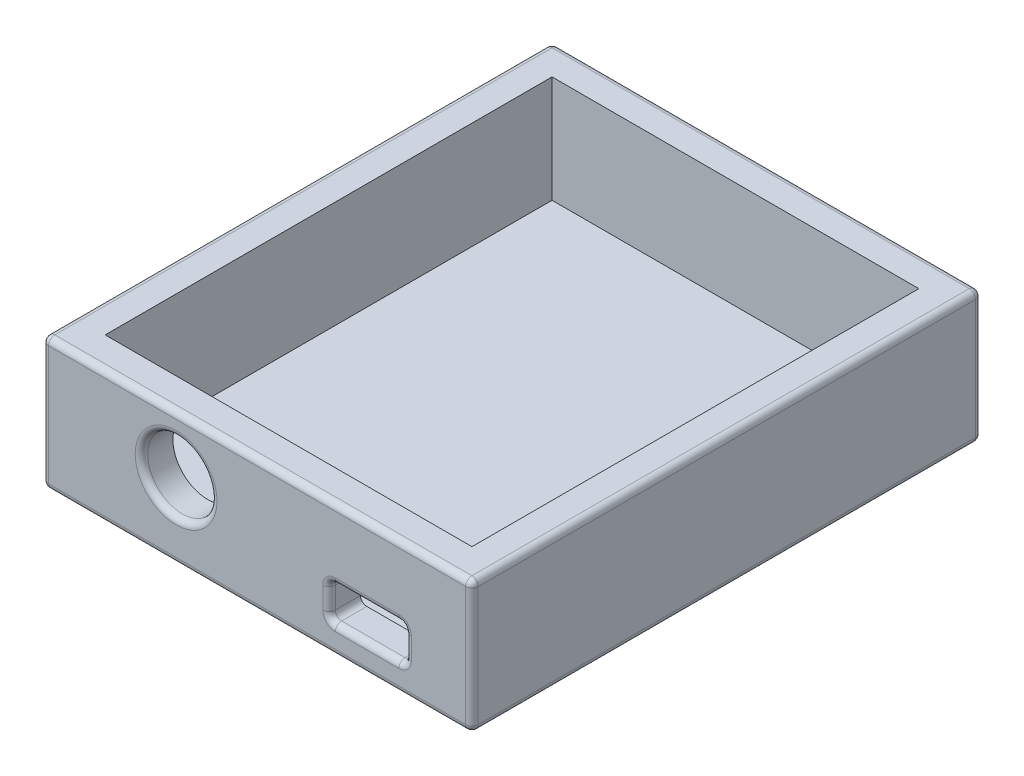
from build123d import *

# Parameters (mm, degrees)
CROQUIS1_W              = 68.34
CROQUIS1_H              = 81.08
SALIENTE_EXTRUIR1_DEPTH = 4
CROQUIS2_W              = 68.34
CROQUIS2_H              = 81.08
CROQUIS2_W_2            = 58.34
CROQUIS2_H_2            = 71.08
SALIENTE_EXTRUIR2_DEPTH = 17
CROQUIS3_R              = 5.5
CROQUIS3_W              = 12.087237368
CROQUIS3_H              = 5.44
CORTAR_EXTRUIR1_DEPTH   = 8
REDONDEO1_R             = 1
REDONDEO2_R             = 1


with BuildPart() as part:
    # Croquis1 → Saliente-Extruir1 (new body)
    with BuildSketch(Plane.XZ.offset(-29.575210532)):
        with Locations((26.509736299, 54.571399583)):
            Rectangle(CROQUIS1_W, CROQUIS1_H)
    extrude(amount=SALIENTE_EXTRUIR1_DEPTH)

    # Croquis2 → Saliente-Extruir2 (add)
    with BuildSketch(Plane(origin=(0, 29.575210532, 0), x_dir=(1, 0, 0), z_dir=(0, 1, 0))):
        with Locations((26.509736299, -54.571399583)):
            Rectangle(CROQUIS2_W, CROQUIS2_H)
        with Locations((26.509736299, -54.571399583)):
            Rectangle(CROQUIS2_W_2, CROQUIS2_H_2, mode=Mode.SUBTRACT)
    extrude(amount=SALIENTE_EXTRUIR2_DEPTH)

    # Croquis3 → Cortar-Extruir1 (cut)
    with BuildSketch(Plane.XY.offset(95.111399583)):
        with Locations((13.616696299, 37.550210532)):
            Circle(CROQUIS3_R)
        with Locations((43.998193346, 32.700210532)):
            Rectangle(CROQUIS3_W, CROQUIS3_H)
    extrude(amount=-CORTAR_EXTRUIR1_DEPTH, mode=Mode.SUBTRACT)

    # Redondeo1
    redondeo1_edges = [part.edges().sort_by_distance(p)[0] for p in [
        (37.954574662, 29.980210532, 92.611399583),
        (37.954574662, 35.420210532, 92.611399583),
        (50.04181203, 35.420210532, 92.611399583),
        (50.04181203, 29.980210532, 92.611399583),
    ]]
    fillet(redondeo1_edges, radius=REDONDEO1_R)

    # Redondeo2
    redondeo2_edges = [part.edges().sort_by_distance(p)[0] for p in [
        (60.679736299, 25.575210532, 54.571399583),
        (26.509736299, 46.575210532, 14.031399583),
        (-7.660263701, 46.575210532, 54.571399583),
        (26.509736299, 46.575210532, 95.111399583),
        (60.679736299, 46.575210532, 54.571399583),
        (26.509736299, 25.575210532, 95.111399583),
        (-7.660263701, 25.575210532, 54.571399583),
        (8.116696299, 37.550210532, 95.111399583),
        (37.954574662, 32.700210532, 95.111399583),
        (43.998193346, 35.420210532, 95.111399583),
        (50.04181203, 32.700210532, 95.111399583),
        (43.998193346, 29.980210532, 95.111399583),
        (38.247467881, 35.127317313, 95.111399583),
        (49.748918811, 35.127317313, 95.111399583),
        (49.748918811, 30.27310375, 95.111399583),
        (38.247467881, 30.27310375, 95.111399583),
        (-7.660263701, 36.075210532, 95.111399583),
        (60.679736299, 36.075210532, 95.111399583),
        (60.679736299, 36.075210532, 14.031399583),
        (-7.660263701, 36.075210532, 14.031399583),
        (26.509736299, 25.575210532, 14.031399583),
    ]]
    fillet(redondeo2_edges, radius=REDONDEO2_R)


solid = part.part
